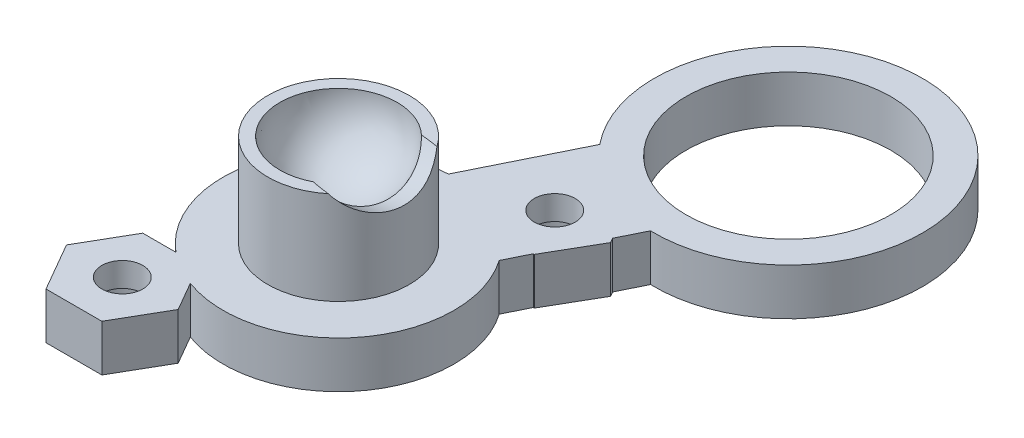
from build123d import *

# Parameters (mm, degrees)
RETAINER_FEATURE_1_PROFILE_R  = 3.8
RETAINER_FEATURE_1_DEPTH      = 5.02
RETAINER_FEATURE_2_PROFILE_R  = 6.2
RETAINER_FEATURE_2_DEPTH      = 2.5
RETAINER_FEATURE_5_DEPTH      = 2.5
RETAINER_FEATURE_8_DEPTH      = 2.5
RETAINER_FEATURE_12_DEPTH     = 2.5
RETAINER_FEATURE_13_PROFILE_R = 7.2
RETAINER_FEATURE_13_DEPTH     = 2.5
RETAINER_FEATURE_14_PROFILE_R = 5.5
RETAINER_FEATURE_14_DEPTH     = 2.7
RETAINER_FEATURE_15_PROFILE_R = 1.1
RETAINER_FEATURE_15_DEPTH     = 3.75
RETAINER_FEATURE_16_PROFILE_R = 2.1
RETAINER_FEATURE_16_DEPTH     = 1.45
RETAINER_FEATURE_17_PROFILE_R = 1.1
RETAINER_FEATURE_17_DEPTH     = 3.75
RETAINER_FEATURE_18_PROFILE_R = 2.1
RETAINER_FEATURE_18_DEPTH     = 1.45


with BuildPart() as part:
    # Retainer Feature 1 profile → Retainer Feature 1 (new body)
    with BuildSketch(Plane(origin=(0, -101, 0), x_dir=(-1, 0, 0), z_dir=(0, -1, 0))):
        with Locations(Location((82.27241336, 15, 0), (0, 0, 90))):
            Circle(RETAINER_FEATURE_1_PROFILE_R)
    extrude(amount=RETAINER_FEATURE_1_DEPTH)

    # Retainer Feature 2 profile → Retainer Feature 2 (add)
    with BuildSketch(Plane(origin=(0, -106, 0), x_dir=(-1, 0, 0), z_dir=(0, -1, 0))):
        with Locations(Location((82.27241336, 15, 0), (0, 0, 90))):
            Circle(RETAINER_FEATURE_2_PROFILE_R)
    extrude(amount=RETAINER_FEATURE_2_DEPTH)

    # Middle Right Floating Compression Ball R → Retainer Feature 5 (add)
    with BuildSketch(Plane(origin=(0, -106, 0), x_dir=(-1, 0, 0), z_dir=(0, -1, 0))):
        Polygon((83.52241336, 7.638784068), (85.02241336, 5.040707856), (88.02241336, 5.040707856), (89.52241336, 7.638784068), (88.02241336, 10.236860279), (85.02241336, 10.236860279), align=None)
    extrude(amount=RETAINER_FEATURE_5_DEPTH)

    # Middle Right Floating Compression Ba 2 → Retainer Feature 8 (add)
    with BuildSketch(Plane(origin=(0, -106, 0), x_dir=(-1, 0, 0), z_dir=(0, -1, 0))):
        Polygon((75.02241336, 22.361215932), (76.52241336, 19.763139721), (79.52241336, 19.763139721), (81.02241336, 22.361215932), (79.52241336, 24.959292144), (76.52241336, 24.959292144), align=None)
    extrude(amount=RETAINER_FEATURE_8_DEPTH)

    # Retainer Feature 9 profile → Retainer Feature 9 (revolve, cut)
    with BuildSketch(Plane(origin=(0, -101, 0), x_dir=(-1, 0, 0), z_dir=(0, -1, 0))):
        with BuildLine():
            Line((82.27241336, 11.85), (82.27241336, 18.15))
            ThreePointArc((82.27241336, 18.15), (79.12241336, 15), (82.27241336, 11.85))
        make_face()
    revolve(axis=Axis((-82.27241336, -101, -25), (0, 0, 1)), mode=Mode.SUBTRACT)

    # Middle Right Floating Compression Ba 3 → Retainer Feature 12 (add)
    with BuildSketch(Plane(origin=(0, -106, 0), x_dir=(-1, 0, 0), z_dir=(0, -1, 0))):
        Polygon((84.962821054, 16.327292899), (76.98205894, 32.504207435), (71.601243552, 29.849621637), (79.582005666, 13.672707101), align=None)
    extrude(amount=RETAINER_FEATURE_12_DEPTH)

    # Retainer Feature 13 profile → Retainer Feature 13 (add)
    with BuildSketch(Plane(origin=(0, -106, 0), x_dir=(-1, 0, 0), z_dir=(0, -1, 0))):
        with Locations((74.291651246, 31.176914536)):
            Circle(RETAINER_FEATURE_13_PROFILE_R)
    extrude(amount=RETAINER_FEATURE_13_DEPTH)

    # Retainer Feature 14 profile → Retainer Feature 14 (cut)
    with BuildSketch(Plane(origin=(0, -105.9, 0), x_dir=(-1, 0, 0), z_dir=(0, -1, 0))):
        with Locations(Location((74.291651246, 31.176914536, 0), (0, 0, 270))):
            Circle(RETAINER_FEATURE_14_PROFILE_R)
    extrude(amount=RETAINER_FEATURE_14_DEPTH, mode=Mode.SUBTRACT)

    # Retainer Feature 15 profile → Retainer Feature 15 (cut)
    with BuildSketch(Plane(origin=(0, -105, 0), x_dir=(-1, 0, 0), z_dir=(0, -1, 0))):
        with Locations(Location((86.52241336, 7.638784068, 0), (0, 0, 90))):
            Circle(RETAINER_FEATURE_15_PROFILE_R)
    extrude(amount=RETAINER_FEATURE_15_DEPTH, mode=Mode.SUBTRACT)

    # Retainer Feature 16 profile → Retainer Feature 16 (cut)
    with BuildSketch(Plane(origin=(0, -107.3, 0), x_dir=(-1, 0, 0), z_dir=(0, -1, 0))):
        with Locations(Location((86.52241336, 7.638784068, 0), (0, 0, 90))):
            Circle(RETAINER_FEATURE_16_PROFILE_R)
    extrude(amount=RETAINER_FEATURE_16_DEPTH, mode=Mode.SUBTRACT)

    # Retainer Feature 17 profile → Retainer Feature 17 (cut)
    with BuildSketch(Plane(origin=(0, -105, 0), x_dir=(-1, 0, 0), z_dir=(0, -1, 0))):
        with Locations(Location((78.02241336, 22.361215932, 0), (0, 0, 90))):
            Circle(RETAINER_FEATURE_17_PROFILE_R)
    extrude(amount=RETAINER_FEATURE_17_DEPTH, mode=Mode.SUBTRACT)

    # Retainer Feature 18 profile → Retainer Feature 18 (cut)
    with BuildSketch(Plane(origin=(0, -107.3, 0), x_dir=(-1, 0, 0), z_dir=(0, -1, 0))):
        with Locations(Location((78.02241336, 22.361215932, 0), (0, 0, 90))):
            Circle(RETAINER_FEATURE_18_PROFILE_R)
    extrude(amount=RETAINER_FEATURE_18_DEPTH, mode=Mode.SUBTRACT)

    # Articulation Throat Sketch → Articulation Throat (revolve, cut)
    with BuildSketch(Plane(origin=(21.848129609, -32.292361412, -7.122138515), x_dir=(-0.8343429620590533, -0.5383086561091639, -0.11872494439026368), z_dir=(0.551245699903886, -0.8147619813060818, -0.17969722356136372))):
        Polygon((124.793457491, -7.104979762), (124.793457491, -4.804979762), (101.793457491, 1.915020238), (101.793457491, -7.104979762), align=None)
    revolve(axis=Axis((-90.61584298, -106.383086561, -16.187249444), (0.8343429620590537, 0.5383086561091633, 0.11872494439026321)), mode=Mode.SUBTRACT)


solid = part.part
